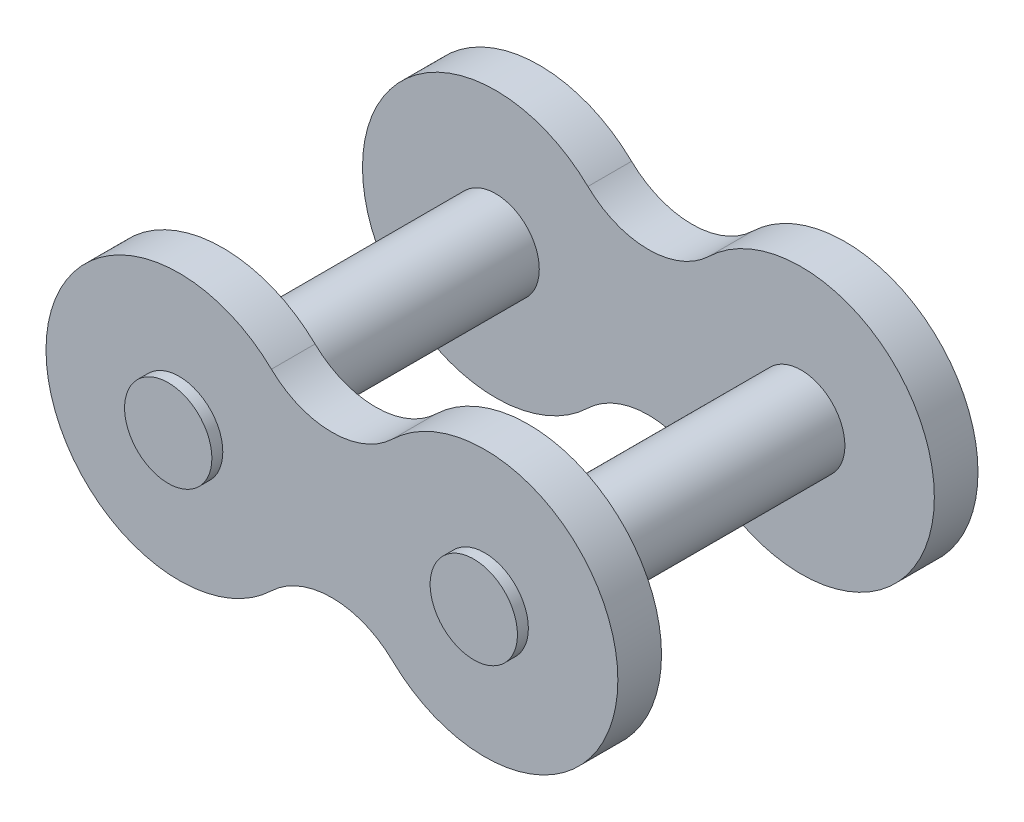
from build123d import *

# Parameters (mm, degrees)
CROQUIS1_R                   = 2
SALIENTE_EXTRUIR1_DEPTH      = 2
SALIENTE_EXTRUIR2_DEPTH      = 15
SALIENTE_EXTRUIR2_DEPTH_BACK = 2.5
CROQUIS3_R                   = 2


with BuildPart() as part:
    # Croquis1 → Saliente-Extruir1 (new body)
    with BuildSketch(Plane.XY):
        with BuildLine():
            ThreePointArc((-2.772277228, 4.397312834), (-13.1, 0), (-2.772277228, -4.397312834))
            ThreePointArc((-2.772277228, -4.397312834), (0, -3.28079666), (2.772277228, -4.397312834))
            ThreePointArc((2.772277228, -4.397312834), (13.1, 0), (2.772277228, 4.397312834))
            ThreePointArc((2.772277228, 4.397312834), (0, 3.28079666), (-2.772277228, 4.397312834))
        make_face()
        with Locations((-7, 0)):
            Circle(CROQUIS1_R, mode=Mode.SUBTRACT)
        with Locations(Location((7, 0, 0), (0, 0, 180))):
            Circle(CROQUIS1_R, mode=Mode.SUBTRACT)
    saliente_extruir1 = extrude(amount=SALIENTE_EXTRUIR1_DEPTH)

    # Croquis3 → Saliente-Extruir2 (add, two sides: drawn at the far end of the back side and taken through both)
    with BuildSketch(Plane.XY.offset(2).offset(-SALIENTE_EXTRUIR2_DEPTH_BACK)):
        with Locations((-7, 0)):
            Circle(CROQUIS3_R)
        with Locations((7, 0)):
            Circle(CROQUIS3_R)
    extrude(amount=SALIENTE_EXTRUIR2_DEPTH + SALIENTE_EXTRUIR2_DEPTH_BACK)

    # Simetría1: Saliente-Extruir1 across plane
    add(saliente_extruir1.mirror(Plane.XY.offset(8.25)))


solid = part.part
